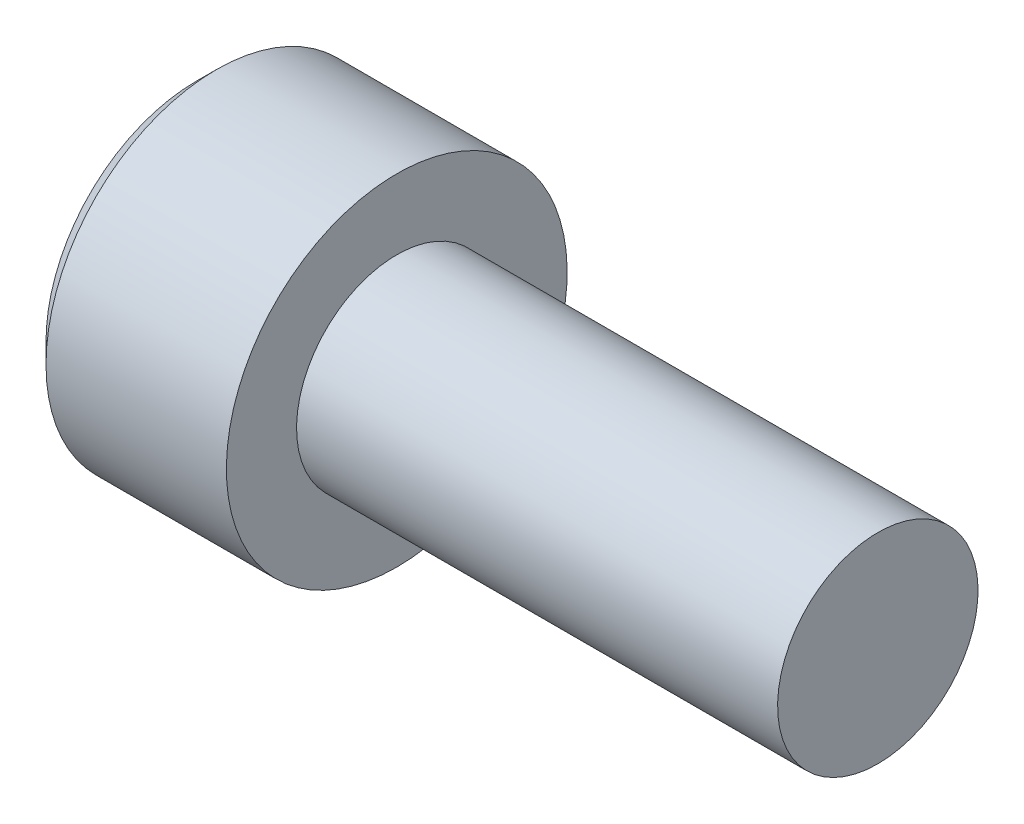
from build123d import *

# Parameters (mm, degrees)
CUT_EXTRUDE1_DEPTH = 2.5
CHAMFER1_SIZE      = 0.5


with BuildPart() as part:
    # Sketch1 → Revolve1 (revolve)
    with BuildSketch(Plane.XY, mode=Mode.PRIVATE) as revolve1_sk:
        Polygon((-5, 0), (-5, 4.25), (0, 4.25), (0, 2.5), (12, 2.5), (12, 0), align=None)
    revolve(revolve1_sk.sketch.rotate(Axis((-5, 0, 0), (1, 0, 0)), 180), axis=Axis((-5, 0, 0), (1, 0, 0)))

    # Sketch2 → Cut-Revolve1 (revolve, cut)
    with BuildSketch(Plane.XY, mode=Mode.PRIVATE) as cut_revolve1_sk:
        Polygon((-5, 0), (-1.345299462, 0), (-2.5, 2), (-5, 2), align=None)
    revolve(cut_revolve1_sk.sketch.rotate(Axis((-5, 0, 0), (1, 0, 0)), 180), axis=Axis((-5, 0, 0), (1, 0, 0)), mode=Mode.SUBTRACT)

    # Sketch3 → Cut-Extrude1 (cut)
    with BuildSketch(Plane.ZY.offset(5)):
        Polygon((0, 2.309401077), (-2, 1.154700538), (-2, -1.154700538), (0, -2.309401077), (2, -1.154700538), (2, 1.154700538), align=None)
    extrude(amount=-CUT_EXTRUDE1_DEPTH, mode=Mode.SUBTRACT)

    # Chamfer1
    chamfer1_edges = [part.edges().sort_by_distance(p)[0] for p in [
        (-5, 4.25, 0),
    ]]
    chamfer(chamfer1_edges, length=CHAMFER1_SIZE)


solid = part.part
